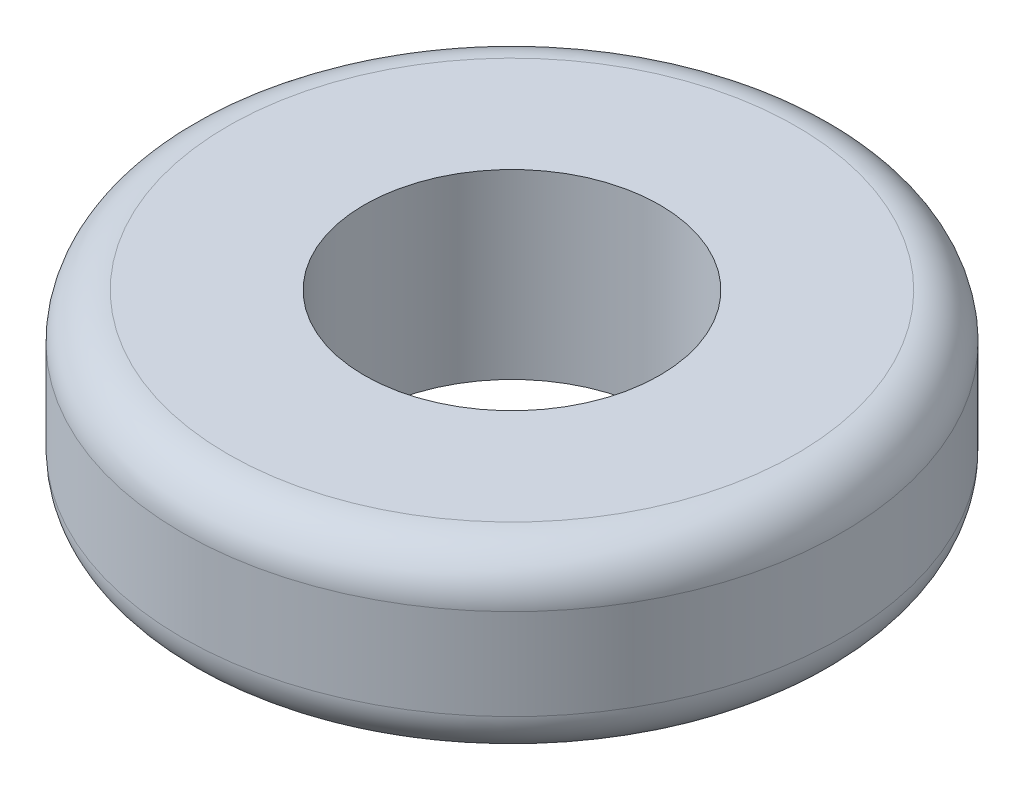
from build123d import *

# Parameters (mm, degrees)
SKETCH1_R           = 7.25
SKETCH1_R_2         = 3.25
BOSS_EXTRUDE1_DEPTH = 4
FILLET1_R           = 1


with BuildPart() as part:
    # Sketch1 → Boss-Extrude1 (new body)
    with BuildSketch(Plane(origin=(0, 0, 0), x_dir=(1, 0, 0), z_dir=(0, 1, 0))):
        with Locations(Location((0, 0, 0), (0, 0, 270))):
            Circle(SKETCH1_R)
        with Locations(Location((0, 0, 0), (0, 0, 270))):
            Circle(SKETCH1_R_2, mode=Mode.SUBTRACT)
    extrude(amount=BOSS_EXTRUDE1_DEPTH)

    # Fillet1
    fillet1_edges = [part.edges().sort_by_distance(p)[0] for p in [
        (0, 0, -7.25),
        (0, 4, -7.25),
    ]]
    fillet(fillet1_edges, radius=FILLET1_R)


solid = part.part
